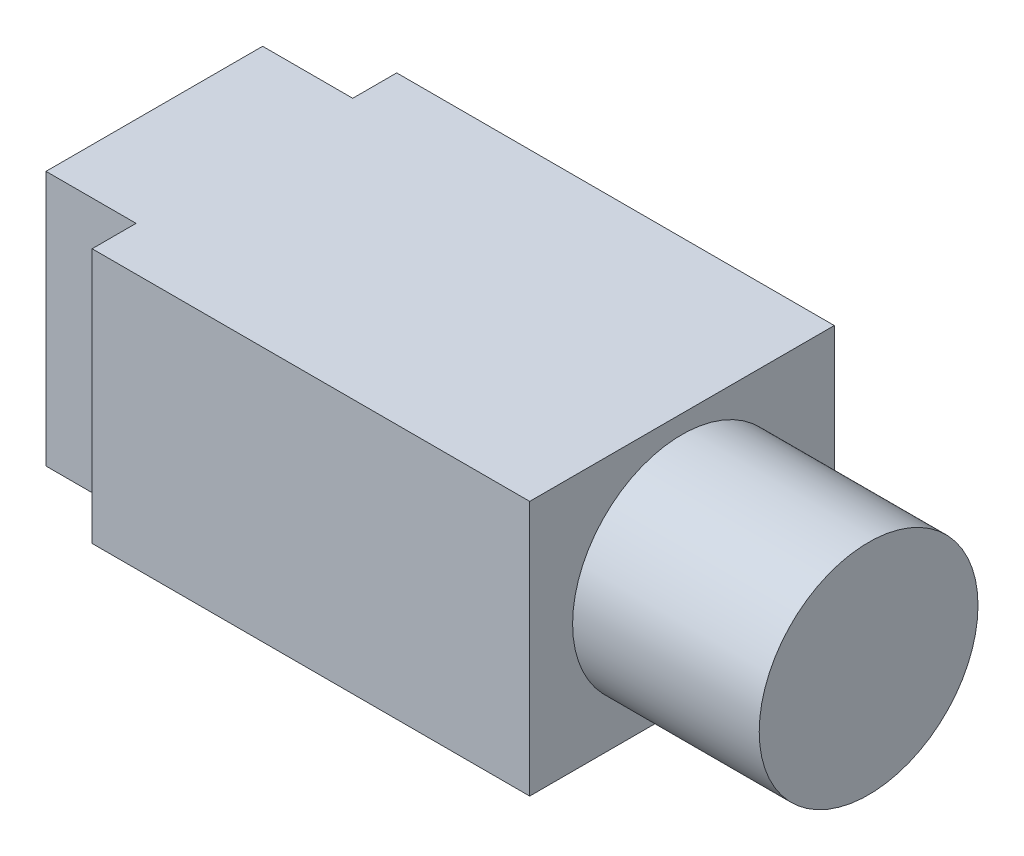
from build123d import *

# Parameters (mm, degrees)
SKETCH1_W           = 4.2
SKETCH1_H           = 10.1
SKETCH1_W_2         = 20.4
SKETCH1_H_2         = 14.2
BOSS_EXTRUDE1_DEPTH = 5.95
SKETCH2_R           = 5.1
BOSS_EXTRUDE2_DEPTH = 8.7


with BuildPart() as part:
    # Sketch1 → Boss-Extrude1 (new, symmetric)
    with BuildSketch(Plane(origin=(0, 0, 0), x_dir=(1, 0, 0), z_dir=(0, 1, 0))):
        with Locations((-12.3, 0)):
            Rectangle(SKETCH1_W, SKETCH1_H)
        Rectangle(SKETCH1_W_2, SKETCH1_H_2)
    extrude(amount=BOSS_EXTRUDE1_DEPTH, both=True)

    # Sketch2 → Boss-Extrude2 (add)
    with BuildSketch(Plane(origin=(10.2, 0, 0), x_dir=(0, 0, -1), z_dir=(1, 0, 0))):
        Circle(SKETCH2_R)
    extrude(amount=BOSS_EXTRUDE2_DEPTH)


solid = part.part
